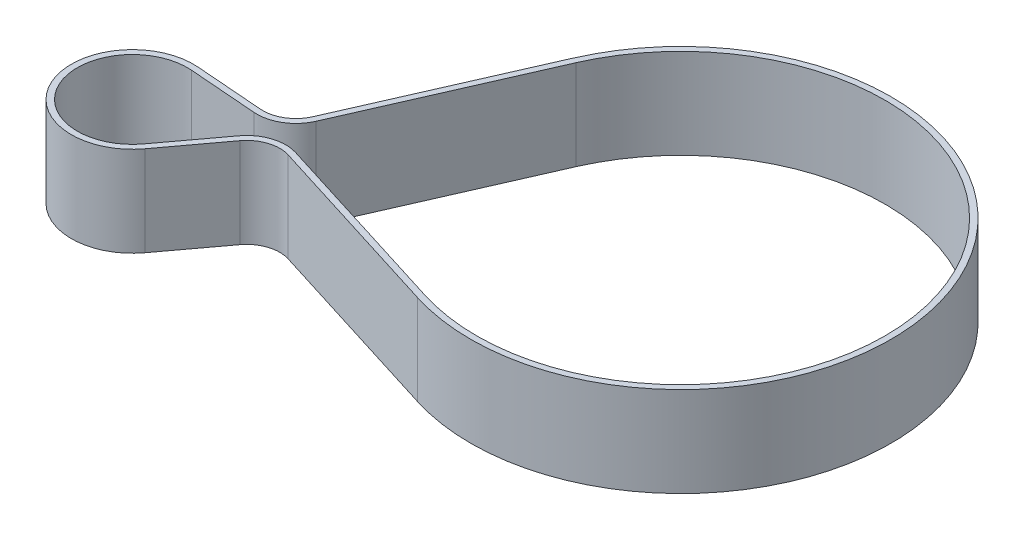
from build123d import *

# Parameters (mm, degrees)
BOSS_EXTRUDE1_DEPTH = 15


with BuildPart() as part:
    # Sketch1 → Boss-Extrude1 (new body)
    with BuildSketch(Plane(origin=(0, 0, 0), x_dir=(1, 0, 0), z_dir=(0, 1, 0))):
        with BuildLine():
            ThreePointArc((8.85981646, -36.734366282), (51.162558776, 11.169517142), (-12.744491466, 10.7302178))
            Line((-12.744491466, 10.7302178), (-25.946747838, -19.365677712))
            ThreePointArc((-25.946747838, -19.365677712), (-28.156287224, -21.87397008), (-31.410106737, -22.639641991))
            Line((-31.410106737, -22.639641991), (-42.677134679, -21.762954271))
            ThreePointArc((-42.677134679, -21.762954271), (-52.722336819, -36.115449465), (-35.30183314, -37.966464293))
            Line((-35.30183314, -37.966464293), (-28.563233928, -28.894210954))
            ThreePointArc((-28.563233928, -28.894210954), (-25.848867686, -26.943362215), (-22.506228219, -26.924486508))
            Line((-22.506228219, -26.924486508), (8.85981646, -36.734366282))
        make_face()
        with BuildLine():
            Line((-42.754710221, -22.759940748), (-31.487682279, -23.636628468))
            ThreePointArc((-31.487682279, -23.636628468), (-27.642259218, -22.731743482), (-25.030985399, -19.767397956))
            Line((-25.030985399, -19.767397956), (-11.828729026, 10.328497556))
            ThreePointArc((-11.828729026, 10.328497556), (50.252405495, 10.755245488), (9.158312959, -35.779955553))
            Line((9.158312959, -35.779955553), (-22.20773172, -25.970075778))
            ThreePointArc((-22.20773172, -25.970075778), (-26.158123817, -25.992383432), (-29.366011194, -28.297931942))
            Line((-29.366011194, -28.297931942), (-36.104610407, -37.370185281))
            ThreePointArc((-36.104610407, -37.370185281), (-51.812183538, -35.701177811), (-42.754710221, -22.759940748))
        make_face(mode=Mode.SUBTRACT)
    extrude(amount=BOSS_EXTRUDE1_DEPTH)


solid = part.part
